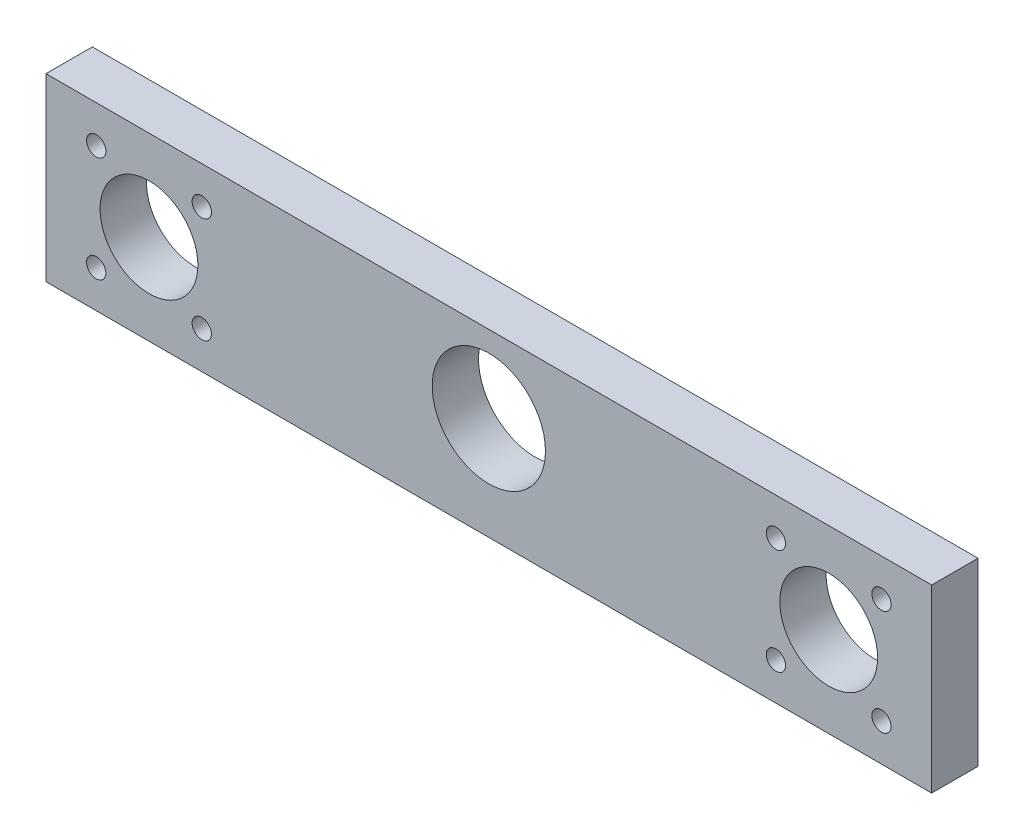
from build123d import *

# Parameters (mm, degrees)
SKETCH1_W           = 172
SKETCH1_H           = 35
BOSS_EXTRUDE1_DEPTH = 9
SKETCH2_R           = 1.875
SKETCH2_R_2         = 9.5
SKETCH2_R_3         = 11
CUT_EXTRUDE1_DEPTH  = 176.755512005


with BuildPart() as part:
    # Sketch1 → Boss-Extrude1 (new body)
    with BuildSketch(Plane.XY):
        with Locations((86, 17.5)):
            Rectangle(SKETCH1_W, SKETCH1_H)
    extrude(amount=BOSS_EXTRUDE1_DEPTH)

    # Sketch2 → Cut-Extrude1 (cut, through all)
    with BuildSketch(Plane.XY.offset(9)):
        with Locations((9.75, 27.75)):
            Circle(SKETCH2_R)
        with Locations((30.25, 27.75)):
            Circle(SKETCH2_R)
        with Locations((9.75, 7.25)):
            Circle(SKETCH2_R)
        with Locations((30.25, 7.25)):
            Circle(SKETCH2_R)
        with Locations((141.75, 27.75)):
            Circle(SKETCH2_R)
        with Locations((162.25, 27.75)):
            Circle(SKETCH2_R)
        with Locations((141.75, 7.25)):
            Circle(SKETCH2_R)
        with Locations((162.25, 7.25)):
            Circle(SKETCH2_R)
        with Locations((20, 17.5)):
            Circle(SKETCH2_R_2)
        with Locations((152, 17.5)):
            Circle(SKETCH2_R_2)
        with Locations((86, 20)):
            Circle(SKETCH2_R_3)
    extrude(amount=-CUT_EXTRUDE1_DEPTH, mode=Mode.SUBTRACT)


solid = part.part
